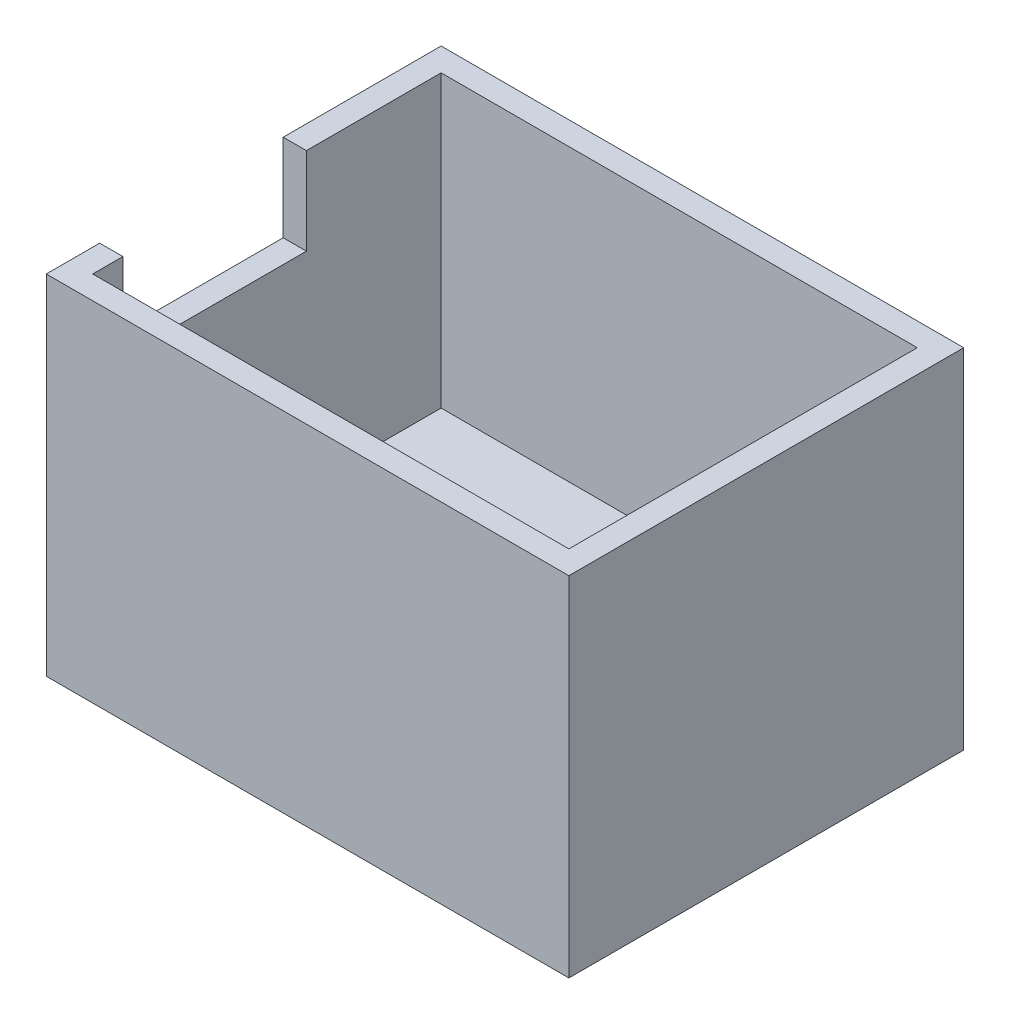
from build123d import *

# Parameters (mm, degrees)
SKETCH1_W             = 57.15
SKETCH1_H             = 43.18
BOSS_EXTRUDE1_DEPTH   = 38.1
SKETCH2_W             = 52.07
SKETCH2_H             = 38.1
CUT_EXTRUDE1_DEPTH    = 31.75
SKETCH3_W             = 18.034
SKETCH3_H             = 15.24
CUT_EXTRUDE2_DEPTH    = 53.290235465
CUT_EXTRUDE3_REACH    = 73.999
SKETCH4_W             = 20.066
SKETCH4_H             = 9.525
CUT_EXTRUDE4_REACH    = 54.29
F_4_CLEARANCE_HOLE1_D = 2.9464
F_6_CLEARANCE_HOLE1_D = 3.6576


with BuildPart() as part:
    # Sketch1 → Boss-Extrude1 (new body)
    with BuildSketch(Plane(origin=(0, 0, 0), x_dir=(1, 0, 0), z_dir=(0, 1, 0))):
        Rectangle(SKETCH1_W, SKETCH1_H)
    extrude(amount=BOSS_EXTRUDE1_DEPTH)

    # Sketch2 → Cut-Extrude1 (cut)
    with BuildSketch(Plane(origin=(0, 38.1, 0), x_dir=(1, 0, 0), z_dir=(0, 1, 0))):
        Rectangle(SKETCH2_W, SKETCH2_H)
    extrude(amount=-CUT_EXTRUDE1_DEPTH, mode=Mode.SUBTRACT)

    # Sketch3 → Cut-Extrude2 (cut, through all)
    with BuildSketch(Plane(origin=(0, 0, 0), x_dir=(-1, 0, 0), z_dir=(0, -1, 0))):
        with Locations((-1.524, 0)):
            Rectangle(SKETCH3_W, SKETCH3_H)
    extrude(amount=-CUT_EXTRUDE2_DEPTH, mode=Mode.SUBTRACT)

    # Sketch4 → Cut-Extrude3 (cut, up to next)
    with BuildSketch(Plane.ZY.offset(28.575), mode=Mode.PRIVATE) as cut_extrude3_sk1:
        with Locations((5.715, 33.3375)):
            Rectangle(SKETCH4_W, SKETCH4_H)
    cut_extrude3_tool1 = extrude(cut_extrude3_sk1.sketch, amount=-CUT_EXTRUDE3_REACH, mode=Mode.PRIVATE) & part.part
    add(cut_extrude3_tool1.solids().sort_by_distance((-28.575, 33.3375, 5.715))[0], mode=Mode.SUBTRACT)

    # Sketch5 → Cut-Extrude4 (cut, up to next)
    with BuildSketch(Plane.XZ, mode=Mode.PRIVATE) as cut_extrude4_sk1:
        with BuildLine():
            Line((17.624947543, -13.716), (24.228947543, -13.716))
            Line((24.228947543, -13.716), (24.228947543, 13.716))
            Line((24.228947543, 13.716), (17.624947543, 13.716))
            ThreePointArc((17.624947543, 13.716), (15.828896319, 12.972051224), (15.084947543, 11.176))
            Line((15.084947543, 11.176), (15.084947543, -11.176))
            ThreePointArc((15.084947543, -11.176), (15.828896319, -12.972051224), (17.624947543, -13.716))
        make_face()
    cut_extrude4_tool1 = extrude(cut_extrude4_sk1.sketch, amount=-CUT_EXTRUDE4_REACH, mode=Mode.PRIVATE) & part.part
    add(cut_extrude4_tool1.solids().sort_by_distance((19.701649, 0, 0))[0], mode=Mode.SUBTRACT)

    # #4 Clearance Hole1 (through all)
    with Locations(Plane(origin=(0, 0, 0), x_dir=(-1, 0, 0), z_dir=(0, -1, 0))):
        with Locations((-19.656947543, 16.256), (-19.656947543, -16.256)):
            Hole(F_4_CLEARANCE_HOLE1_D / 2)

    # #6 Clearance Hole1 (through all)
    with Locations(Plane(origin=(0, 0, 0), x_dir=(-1, 0, 0), z_dir=(0, -1, 0))):
        with Locations((3.175, 14.605), (3.175, -14.605)):
            Hole(F_6_CLEARANCE_HOLE1_D / 2)


solid = part.part
